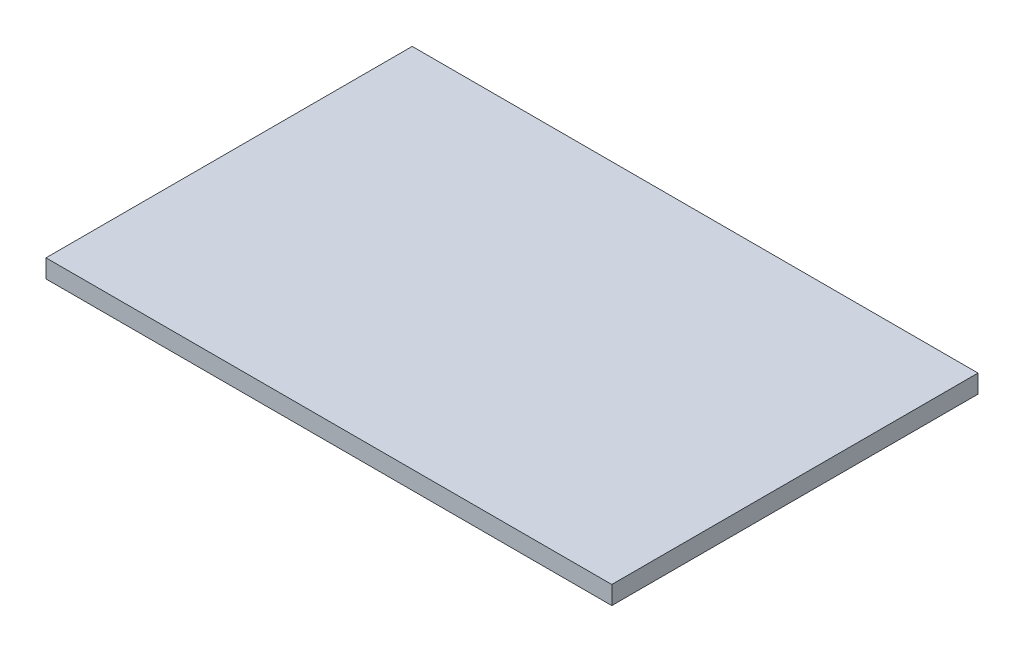
from build123d import *

# Parameters (mm, degrees)
SKETCH1_W           = 309
SKETCH1_H           = 200
BOSS_EXTRUDE1_DEPTH = 10


with BuildPart() as part:
    # Sketch1 → Boss-Extrude1 (new body)
    with BuildSketch(Plane(origin=(0, 0, 0), x_dir=(1, 0, 0), z_dir=(0, 1, 0))):
        with Locations((154.5, 100)):
            Rectangle(SKETCH1_W, SKETCH1_H)
    extrude(amount=BOSS_EXTRUDE1_DEPTH)


solid = part.part
